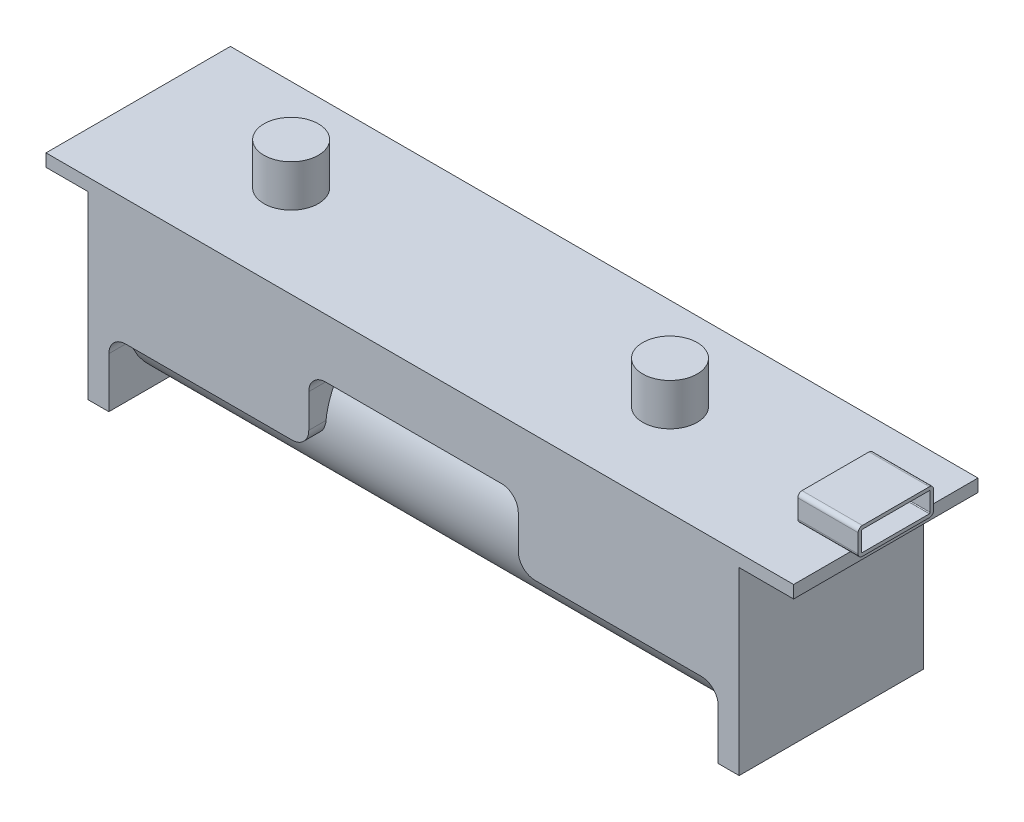
from build123d import *

# Parameters (mm, degrees)
SKETCH1_W                = 89.2
SKETCH1_H                = 22
BOSS_EXTRUDE1_DEPTH      = 1.5
BOSS_EXTRUDE2_DEPTH      = 1.2
BOSS_EXTRUDE2_DEPTH_BACK = 6
SKETCH4_R                = 3.25
BOSS_EXTRUDE3_DEPTH      = 5
BOSS_EXTRUDE3_2_DEPTH    = 5
SKETCH5_W                = 77.7
SKETCH5_H                = 22
BOSS_EXTRUDE4_DEPTH      = 21.5
CUT_EXTRUDE1_DEPTH       = 31.5
SKETCH7_R                = 9
BOSS_EXTRUDE5_DEPTH      = 72.7


with BuildPart() as part:
    # Sketch1 → Boss-Extrude1 (new body)
    with BuildSketch(Plane(origin=(0, 0, 0), x_dir=(1, 0, 0), z_dir=(0, 1, 0))):
        with Locations((44.6, 11)):
            Rectangle(SKETCH1_W, SKETCH1_H)
    extrude(amount=BOSS_EXTRUDE1_DEPTH)

    # Sketch5 → Boss-Extrude4 (add)
    with BuildSketch(Plane.XZ):
        with Locations((43.85, -11)):
            Rectangle(SKETCH5_W, SKETCH5_H)
    extrude(amount=BOSS_EXTRUDE4_DEPTH)

    # Sketch8 → Cut-Extrude1 (cut)
    with BuildSketch(Plane.XY):
        with BuildLine():
            Line((7.5, -21.5), (7.5, -15.5))
            ThreePointArc((7.5, -15.5), (8.085786438, -14.085786438), (9.5, -13.5))
            Line((9.5, -13.5), (29.35, -13.5))
            ThreePointArc((29.35, -13.5), (30.764213562, -12.914213562), (31.35, -11.5))
            Line((31.35, -11.5), (31.35, -7.5))
            ThreePointArc((31.35, -7.5), (31.935786438, -6.085786438), (33.35, -5.5))
            Line((33.35, -5.5), (54.35, -5.5))
            ThreePointArc((54.35, -5.5), (55.764213562, -6.085786438), (56.35, -7.5))
            Line((56.35, -7.5), (56.35, -11.5))
            ThreePointArc((56.35, -11.5), (56.935786438, -12.914213562), (58.35, -13.5))
            Line((58.35, -13.5), (78.2, -13.5))
            ThreePointArc((78.2, -13.5), (79.614213562, -14.085786438), (80.2, -15.5))
            Line((80.2, -15.5), (80.2, -21.5))
            Line((80.2, -21.5), (7.5, -21.5))
        make_face()
    extrude(amount=-CUT_EXTRUDE1_DEPTH, mode=Mode.SUBTRACT)


with BuildPart() as body_2:
    # Sketch3 → Boss-Extrude2 (new, two sides: drawn at the far end of the back side and taken through both)
    with BuildSketch(Plane(origin=(89.2, 0, 0), x_dir=(0, 0, -1), z_dir=(1, 0, 0)).offset(-BOSS_EXTRUDE2_DEPTH_BACK)):
        with BuildLine():
            Line((7, 4.7), (15, 4.7))
            ThreePointArc((15, 4.7), (15.353553391, 4.553553391), (15.5, 4.2))
            Line((15.5, 4.2), (15.5, 2))
            ThreePointArc((15.5, 2), (15.353553391, 1.646446609), (15, 1.5))
            Line((15, 1.5), (7, 1.5))
            ThreePointArc((7, 1.5), (6.646446609, 1.646446609), (6.5, 2))
            Line((6.5, 2), (6.5, 4.2))
            ThreePointArc((6.5, 4.2), (6.646446609, 4.553553391), (7, 4.7))
        make_face()
        with BuildLine():
            Line((7, 4.3), (15, 4.3))
            ThreePointArc((15, 4.3), (15.070710678, 4.270710678), (15.1, 4.2))
            Line((15.1, 4.2), (15.1, 2))
            ThreePointArc((15.1, 2), (15.070710678, 1.929289322), (15, 1.9))
            Line((15, 1.9), (7, 1.9))
            ThreePointArc((7, 1.9), (6.929289322, 1.929289322), (6.9, 2))
            Line((6.9, 2), (6.9, 4.2))
            ThreePointArc((6.9, 4.2), (6.929289322, 4.270710678), (7, 4.3))
        make_face(mode=Mode.SUBTRACT)
    extrude(amount=BOSS_EXTRUDE2_DEPTH + BOSS_EXTRUDE2_DEPTH_BACK)


with BuildPart() as body_3:
    # Sketch4 → Boss-Extrude3 (new body)
    with BuildSketch(Plane(origin=(0, 1.5, 0), x_dir=(1, 0, 0), z_dir=(0, 1, 0))):
        with Locations(Location((18.25, 11, 0), (0, 0, 270))):
            Circle(SKETCH4_R)
    extrude(amount=BOSS_EXTRUDE3_DEPTH)


with BuildPart() as body_4:
    # Sketch4 → Boss-Extrude3 2 (new body)
    with BuildSketch(Plane(origin=(0, 1.5, 0), x_dir=(1, 0, 0), z_dir=(0, 1, 0))):
        with Locations(Location((63.45, 11, 0), (0, 0, 270))):
            Circle(SKETCH4_R)
    extrude(amount=BOSS_EXTRUDE3_2_DEPTH)


with BuildPart() as body_5:
    # Sketch7 → Boss-Extrude5 (new body)
    with BuildSketch(Plane(origin=(80.2, 0, 0), x_dir=(0, 0, -1), z_dir=(1, 0, 0))):
        with Locations((11, -12.5)):
            Circle(SKETCH7_R)
    extrude(amount=-BOSS_EXTRUDE5_DEPTH)


solid = Compound([part.part, body_2.part, body_3.part, body_4.part, body_5.part])
